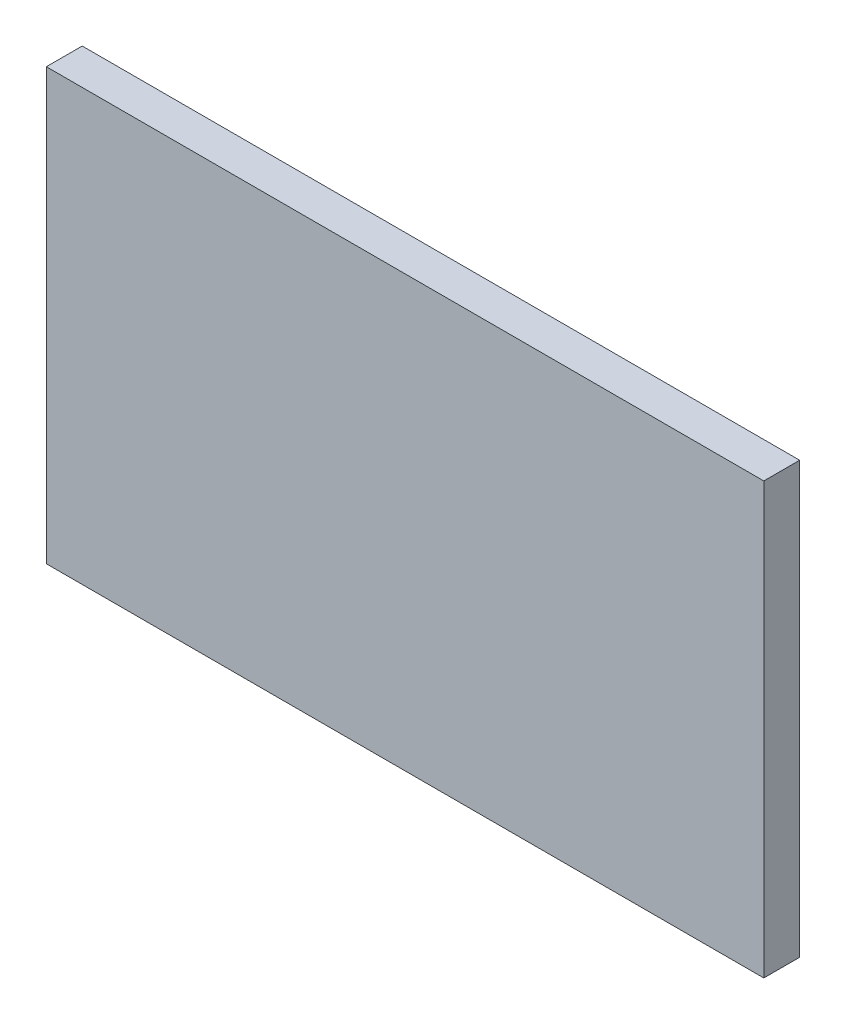
from build123d import *

# Parameters (mm, degrees)
SKETCH1_W           = 15
SKETCH1_H           = 0.75
BOSS_EXTRUDE1_DEPTH = 9


with BuildPart() as part:
    # Sketch1 → Boss-Extrude1 (new body)
    with BuildSketch(Plane(origin=(0, 0, 0), x_dir=(1, 0, 0), z_dir=(0, 1, 0))):
        with Locations((0, -0.125)):
            Rectangle(SKETCH1_W, SKETCH1_H)
    extrude(amount=BOSS_EXTRUDE1_DEPTH)


solid = part.part
